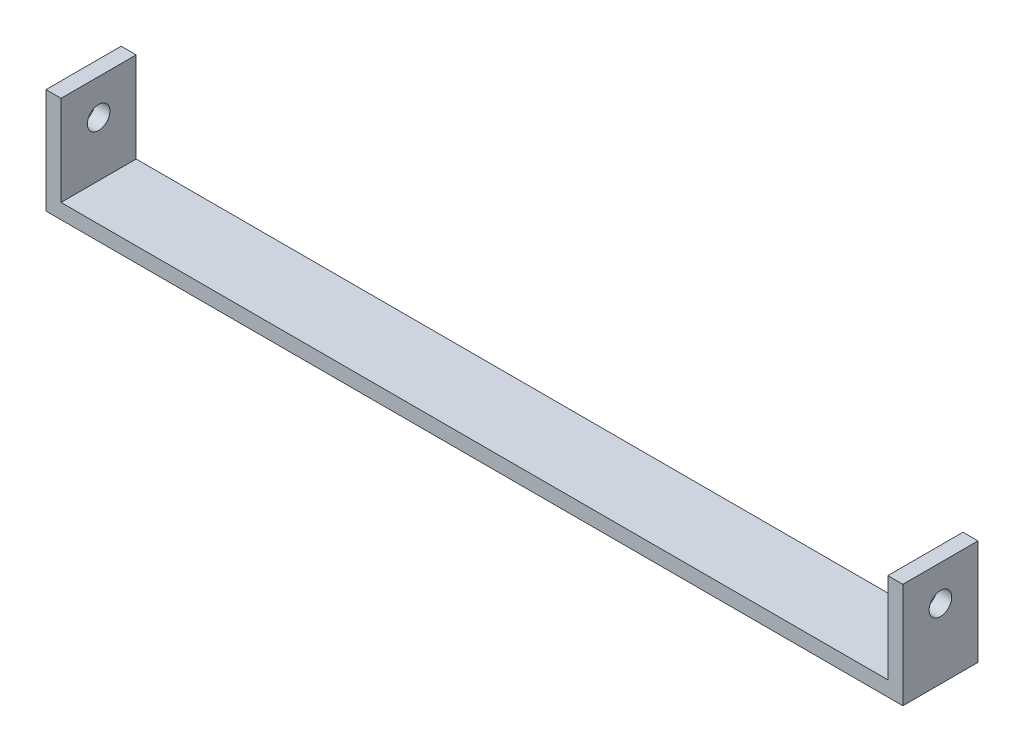
from build123d import *

# Parameters (mm, degrees)
BOSS_EXTRU_1_DEPTH           = 10
ENL_V_MAT_EXTRU_1_DEPTH      = 116.290936331
ENL_V_MAT_EXTRU_1_DEPTH_BACK = 116.290936331
ESQUISSE2_R                  = 1.5


with BuildPart() as part:
    # Esquisse1 → Boss.-Extru.1 (new body)
    with BuildSketch(Plane.XY):
        Polygon((57, 0), (-57, 0), (-57, 14), (-55, 14), (-55, 2), (55, 2), (55, 14), (57, 14), align=None)
    extrude(amount=BOSS_EXTRU_1_DEPTH)

    # Esquisse2 → Enlèv. mat.-Extru.1 (cut, two sides: drawn at the far end of the back side and taken through both)
    with BuildSketch(Plane.ZY.offset(57).offset(-ENL_V_MAT_EXTRU_1_DEPTH_BACK)):
        with Locations((5, 9.284897648)):
            Circle(ESQUISSE2_R)
    extrude(amount=ENL_V_MAT_EXTRU_1_DEPTH + ENL_V_MAT_EXTRU_1_DEPTH_BACK, mode=Mode.SUBTRACT)


solid = part.part
